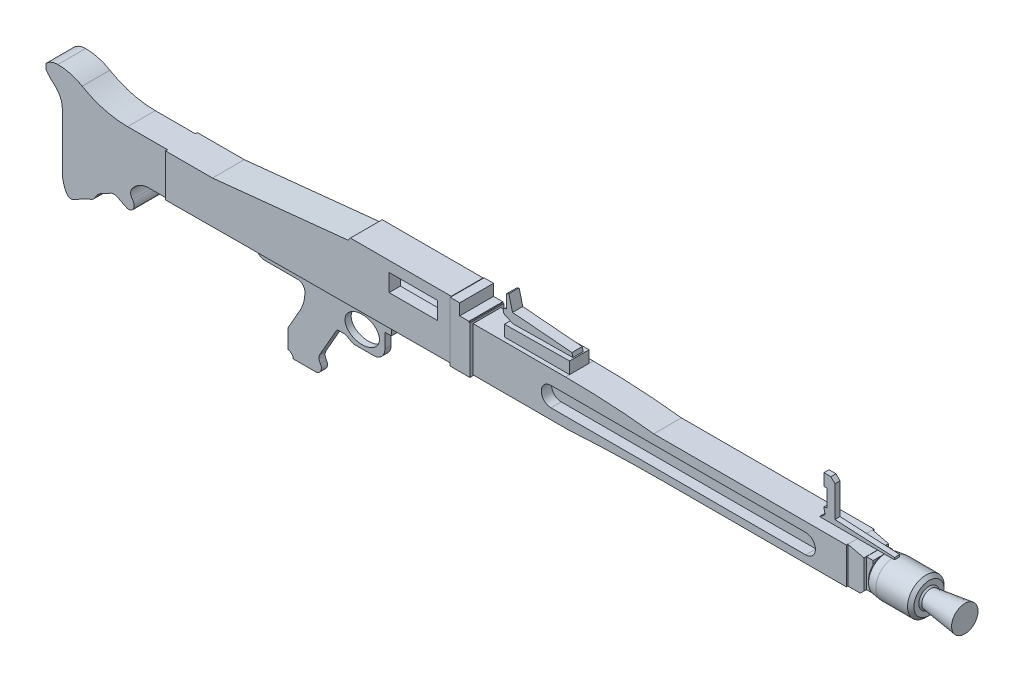
from build123d import *

# Parameters (mm, degrees)
BOSS_EXTRUDE1_DEPTH  = 15.5
BOSS_EXTRUDE2_DEPTH  = 16.5
BOSS_EXTRUDE3_DEPTH  = 13.5
BOSS_EXTRUDE4_DEPTH  = 13.5
BOSS_EXTRUDE5_DEPTH  = 12
SKETCH8_W            = 6.496390684
SKETCH8_H            = 27.893944802
BOSS_EXTRUDE6_DEPTH  = 9.5
BOSS_EXTRUDE7_DEPTH  = 9.5
BOSS_EXTRUDE8_DEPTH  = 5
BOSS_EXTRUDE9_DEPTH  = 2.5
SKETCH12_RX          = 16.762384294
SKETCH12_RY          = 12.789078387
BOSS_EXTRUDE10_DEPTH = 3
CUT_EXTRUDE1_DEPTH   = 10
SKETCH15_W           = 39
SKETCH15_H           = 12.394538065
CUT_EXTRUDE2_DEPTH   = 10
LPATTERN1_COUNT      = 5
LPATTERN1_PITCH      = 65
SKETCH16_W           = 87
SKETCH16_H           = 13
CUT_EXTRUDE3_DEPTH   = 20
SKETCH17_W           = 47
SKETCH17_H           = 17
CUT_EXTRUDE4_DEPTH   = 20


with BuildPart() as part:
    # Sketch3 → Boss-Extrude1 (new, symmetric)
    with BuildSketch(Plane.XY):
        Polygon((133.149858051, 139.895661973), (133.149858051, 98.471820279), (411.749827309, 99.670984239), (411.749827309, 156.44910347), (313.434031377, 156.44910347), (311.324996959, 153.534720699), (179.007614185, 139.895661973), align=None)
    extrude(amount=BOSS_EXTRUDE1_DEPTH, both=True)

    # Sketch4 → Boss-Extrude2 (add, symmetric)
    with BuildSketch(Plane.XY):
        Polygon((411.749827309, 156.033029169), (420.975775825, 156.033029169), (420.975775825, 144.978532204), (430.009114764, 144.978532204), (430.009114764, 143.988577252), (431.019693777, 143.988577252), (431.019693777, 141.994324915), (431.019693777, 97.953675999), (411.749827309, 97.953675999), (411.749827309, 99.670984239), align=None)
    extrude(amount=BOSS_EXTRUDE2_DEPTH, both=True)

    # Sketch5 → Boss-Extrude3 (add, symmetric)
    with BuildSketch(Plane.XY):
        with BuildLine():
            Line((133.149858051, 139.895661973), (94.252855504, 139.895661973))
            ThreePointArc((94.252855504, 139.895661973), (71.313845446, 142.954897437), (49.978282681, 151.918761872))
            ThreePointArc((49.978282681, 151.918761872), (38.545088727, 156.722272414), (26.252647511, 158.361640112))
            ThreePointArc((26.252647511, 158.361640112), (19.992753467, 157.106388363), (14.700767025, 153.534720699))
            Line((14.700767025, 153.534720699), (14.700767025, 148.437439097))
            ThreePointArc((14.700767025, 148.437439097), (18.238668479, 143.863918039), (22.444234475, 139.895661973))
            ThreePointArc((22.444234475, 139.895661973), (28.462546977, 132.28862519), (30.608744585, 122.82918917))
            Line((30.608744585, 122.82918917), (30.608744585, 69.346080174))
            ThreePointArc((30.608744585, 69.346080174), (31.695406767, 61.267845658), (34.878139046, 53.763918499))
            ThreePointArc((34.878139046, 53.763918499), (37.956933722, 51.456084346), (41.765855495, 52.001235761))
            ThreePointArc((41.765855495, 52.001235761), (50.367903613, 56.770738529), (59.228520707, 61.040733047))
            ThreePointArc((59.228520707, 61.040733047), (61.267048723, 62.414327993), (62.721053749, 64.396304009))
            ThreePointArc((62.721053749, 64.396304009), (65.413891541, 68.156904958), (69.158209867, 70.872337731))
            ThreePointArc((69.158209867, 70.872337731), (73.450700222, 73.093711085), (77.692994463, 75.409507404))
            ThreePointArc((77.692994463, 75.409507404), (81.090516464, 76.296497825), (84.488038465, 75.409507404))
            ThreePointArc((84.488038465, 75.409507404), (88.979339547, 73.045671959), (93.588552357, 70.920898865))
            ThreePointArc((93.588552357, 70.920898865), (97.327152104, 70.872337731), (100.005079243, 73.481589057))
            ThreePointArc((100.005079243, 73.481589057), (100.491809305, 77.292238781), (98.889475004, 80.783725895))
            ThreePointArc((98.889475004, 80.783725895), (97.223033107, 84.789475542), (98.233640809, 89.00868529))
            ThreePointArc((98.233640809, 89.00868529), (105.447578681, 95.944937223), (115.130933085, 98.471820279))
            Line((115.130933085, 98.471820279), (133.149858051, 98.471820279))
            Line((133.149858051, 98.471820279), (133.149858051, 139.895661973))
        make_face()
    extrude(amount=BOSS_EXTRUDE3_DEPTH, both=True)

    # Sketch6 → Boss-Extrude4 (add, symmetric)
    with BuildSketch(Plane.XY):
        with BuildLine():
            Line((431.019693777, 141.985108027), (521.143927742, 141.985108027))
            ThreePointArc((521.143927742, 141.985108027), (564.221550984, 140.736824542), (607.154606888, 136.996163292))
            Line((607.154606888, 136.996163292), (794.904816514, 136.996163292))
            Line((794.904816514, 136.996163292), (794.904816514, 101.627825911))
            Line((794.904816514, 101.627825911), (617.7858187, 101.627825911))
            ThreePointArc((617.7858187, 101.627825911), (570.698310194, 100.896770347), (523.656190664, 98.704308341))
            Line((523.656190664, 98.704308341), (431.019693777, 98.704308341))
            Line((431.019693777, 98.704308341), (431.019693777, 141.985108027))
        make_face()
    extrude(amount=BOSS_EXTRUDE4_DEPTH, both=True)

    # Sketch7 → Boss-Extrude5 (add, symmetric)
    with BuildSketch(Plane.XY):
        Polygon((794.904816514, 136.996163292), (810.501213197, 133.220193001), (810.501213197, 105.102603394), (807.026435715, 101.627825911), (794.904816514, 101.627825911), align=None)
    extrude(amount=BOSS_EXTRUDE5_DEPTH, both=True)

    # Sketch8 → Boss-Extrude6 (add, symmetric)
    with BuildSketch(Plane.XY):
        with Locations((813.749408539, 119.049575795)):
            Rectangle(SKETCH8_W, SKETCH8_H)
    extrude(amount=BOSS_EXTRUDE6_DEPTH, both=True)

    # Sketch9 → Boss-Extrude7 (add, symmetric)
    with BuildSketch(Plane.XY):
        Polygon((457.584707407, 141.985108027), (457.584707407, 152.776573918), (521.143927742, 153.534720699), (521.143927742, 141.985108027), align=None)
    extrude(amount=BOSS_EXTRUDE7_DEPTH, both=True)

    # Sketch11 → Boss-Extrude9 (add, symmetric)
    with BuildSketch(Plane.XY):
        Polygon((757.700729864, 136.996163292), (763.234993942, 141.020978106), (761.989784524, 147.247025193), (765.209236223, 147.890915533), (765.209236223, 164.679957037), (761.989784524, 164.679957037), (761.989784524, 176.163554998), (768.769258019, 176.163554998), (772.781599476, 172.151213542), (772.781599476, 141.989474319), (830.884412859, 139.008570699), (830.884412859, 136.996163292), align=None)
    extrude(amount=BOSS_EXTRUDE9_DEPTH, both=True)

    # Sketch12 → Boss-Extrude10 (add, symmetric)
    with BuildSketch(Plane.XY):
        with BuildLine():
            Line((208.842158386, 98.797618874), (208.842158386, 92.008322654))
            ThreePointArc((208.842158386, 92.008322654), (211.374734093, 85.894144033), (217.488912713, 83.361568326))
            Line((217.488912713, 83.361568326), (249.418367521, 83.361568326))
            ThreePointArc((249.418367521, 83.361568326), (254.496678976, 81.258062848), (256.600184454, 76.179751393))
            ThreePointArc((256.600184454, 76.179751393), (255.397255812, 66.969790939), (251.869178098, 58.377755294))
            Line((251.869178098, 58.377755294), (240.010170569, 37.641818809))
            Line((240.010170569, 37.641818809), (240.010170569, 19.245849473))
            ThreePointArc((240.010170569, 19.245849473), (243.672242968, 17.72896942), (245.189123022, 14.066897021))
            Line((245.189123022, 14.066897021), (266.840112738, 14.066897021))
            ThreePointArc((266.840112738, 14.066897021), (271.998110462, 17.187212495), (271.628495834, 23.204246166))
            ThreePointArc((271.628495834, 23.204246166), (270.340295157, 26.829606572), (271.053889863, 30.610278688))
            Line((271.053889863, 30.610278688), (287.239486775, 58.9114252))
            ThreePointArc((287.239486775, 58.9114252), (288.153804085, 59.831372974), (289.4062922, 60.168350083))
            Line((289.4062922, 60.168350083), (295.92740565, 60.168350083))
            Line((295.92740565, 60.168350083), (303.987895413, 55.99154739))
            Line((303.987895413, 55.99154739), (323.584374238, 55.99154739))
            ThreePointArc((323.584374238, 55.99154739), (331.347164696, 59.20700048), (334.562617786, 66.969790939))
            Line((334.562617786, 66.969790939), (334.562617786, 81.258062848))
            Line((334.562617786, 81.258062848), (340.855180353, 81.258062848))
            Line((340.855180353, 81.258062848), (340.855180353, 99.365835944))
            Line((340.855180353, 99.365835944), (208.842158386, 98.797618874))
        make_face()
        with Locations((312.447304179, 72.410281153)):
            Ellipse(SKETCH12_RX, SKETCH12_RY, mode=Mode.SUBTRACT)
    extrude(amount=BOSS_EXTRUDE10_DEPTH, both=True)

    # Sketch13 → Revolve21 (revolve)
    with BuildSketch(Plane.XY, mode=Mode.PRIVATE) as revolve21_sk:
        Polygon((816.997603881, 119.049575795), (816.997603881, 132.996548196), (819.740656944, 135.739601259), (827.99767889, 136.934043607), (858.927588214, 136.934043607), (862.029347768, 133.850634066), (862.029347768, 128.987987545), (863.440032351, 127.585648574), (896.888326318, 131.930945848), (896.888326318, 119.049575795), align=None)
    revolve(revolve21_sk.sketch.rotate(Axis((816.997603881, 119.049575795, 0), (1, 0, 0)), 90), axis=Axis((816.997603881, 119.049575795, 0), (1, 0, 0)))

    # Sketch14 → Cut-Extrude1 (cut)
    with BuildSketch(Plane.XY.offset(13.5)):
        with BuildLine():
            Line((506.973990238, 127.826963558), (755.289068279, 127.826963558))
            ThreePointArc((755.289068279, 127.826963558), (764.766743013, 118.349288824), (755.289068279, 108.87161409))
            Line((755.289068279, 108.87161409), (506.973990238, 108.87161409))
            ThreePointArc((506.973990238, 108.87161409), (497.496315503, 118.349288824), (506.973990238, 127.826963558))
        make_face()
    extrude(amount=-CUT_EXTRUDE1_DEPTH, mode=Mode.SUBTRACT)

    # Sketch15 → Cut-Extrude2 (cut)
    with BuildSketch(Plane(origin=(0, 0, -13.5), x_dir=(-1, 0, 0), z_dir=(0, 0, -1))):
        with Locations((-753.015574956, 118.79889426)):
            Rectangle(SKETCH15_W, SKETCH15_H)
    cut_extrude2 = extrude(amount=-CUT_EXTRUDE2_DEPTH, mode=Mode.SUBTRACT)

    # LPattern1: Cut-Extrude2 ×5
    with Locations(*[(-i * LPATTERN1_PITCH, 0, 0) for i in range(1, LPATTERN1_COUNT)]):
        add(cut_extrude2, mode=Mode.SUBTRACT)

    # Sketch16 → Cut-Extrude3 (cut)
    with BuildSketch(Plane(origin=(0, 0, -15.5), x_dir=(-1, 0, 0), z_dir=(0, 0, -1))):
        with Locations((-355.115432636, 132.94910347)):
            Rectangle(SKETCH16_W, SKETCH16_H)
    extrude(amount=-CUT_EXTRUDE3_DEPTH, mode=Mode.SUBTRACT)

    # Sketch17 → Cut-Extrude4 (cut)
    with BuildSketch(Plane.XY.offset(15.5)):
        with Locations((374.633368208, 137.754171164)):
            Rectangle(SKETCH17_W, SKETCH17_H)
    extrude(amount=-CUT_EXTRUDE4_DEPTH, mode=Mode.SUBTRACT)


with BuildPart() as body_2:
    # Sketch10 → Boss-Extrude8 (new, symmetric)
    with BuildSketch(Plane.XY):
        with BuildLine():
            Line((519.869775561, 153.534720699), (518.91663693, 157.299936474))
            Line((518.91663693, 157.299936474), (460.96580818, 162.160943491))
            Line((460.96580818, 162.160943491), (457.414176457, 176.191074428))
            Line((457.414176457, 176.191074428), (455.046590192, 174.936861902))
            Line((455.046590192, 174.936861902), (455.046590192, 162.160943491))
            ThreePointArc((455.046590192, 162.160943491), (452.846921386, 161.249810839), (451.935788734, 159.050142033))
            ThreePointArc((451.935788734, 159.050142033), (452.846921386, 156.850473227), (455.046590192, 155.939340575))
            Line((455.046590192, 155.939340575), (460.96580818, 152.816904347))
            Line((460.96580818, 152.816904347), (519.869775561, 153.534720699))
        make_face()
    extrude(amount=BOSS_EXTRUDE8_DEPTH, both=True)


solid = Compound([part.part, body_2.part])
